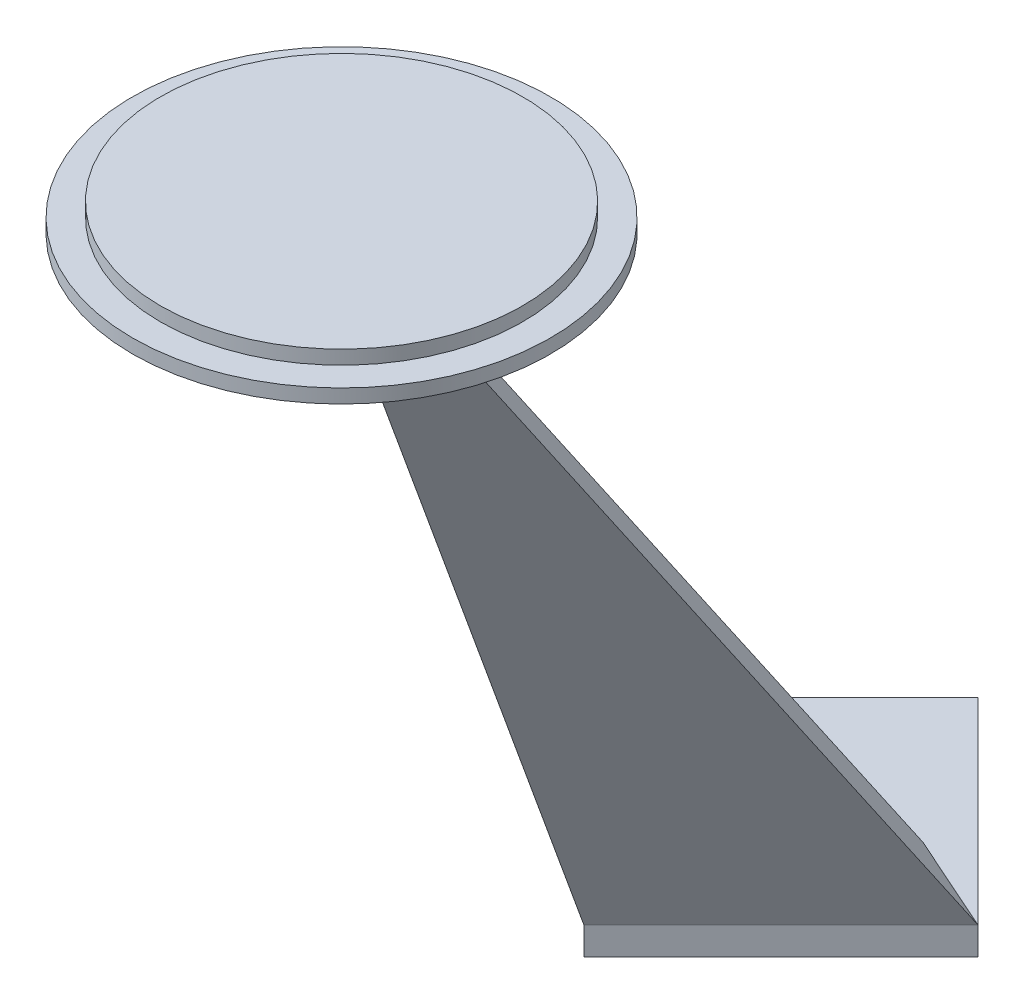
from build123d import *

# Parameters (mm, degrees)
SKETCH1_R           = 1.5
BOSS_EXTRUDE2_DEPTH = 2
BOSS_EXTRUDE3_DEPTH = 55
CUT_EXTRUDE1_DEPTH  = 2
CUT_EXTRUDE2_DEPTH  = 2
SKETCH8_R           = 15
BOSS_EXTRUDE6_DEPTH = 2
CUT_EXTRUDE3_START  = -1
SKETCH12_R          = 15
SKETCH12_R_2        = 13
CUT_EXTRUDE3_DEPTH  = 1


with BuildPart() as part:
    # Sketch1 → Boss-Extrude2 (new body)
    with BuildSketch(Plane(origin=(0, 0, 0), x_dir=(1, 0, 0), z_dir=(0, 1, 0))):
        Polygon((0, 14.142135624), (-14.142135624, 0), (0, -14.142135624), (14.142135624, 0), align=None)
        with Locations(Location((0, 0, 0), (0, 0, 270))):
            Circle(SKETCH1_R, mode=Mode.SUBTRACT)
    extrude(amount=BOSS_EXTRUDE2_DEPTH)

    # Sketch3 → Boss-Extrude3 (add, along a direction that is not the sketch's normal)
    with BuildSketch(Plane(origin=(0, 2, 0), x_dir=(1, 0, 0), z_dir=(0, 1, 0))):
        Polygon((0, -14.142135624), (14.142135624, 0), (12, 0), (0, -12), (-12, 0), (-14.142135624, 0), align=None)
    extrude(amount=BOSS_EXTRUDE3_DEPTH, dir=(0, 0.9396926207859093, 0.34202014332566616))

    # Sketch5 → Cut-Extrude1 (cut)
    with BuildSketch(Plane(origin=(6.290436868, -2.289531781, 6.290436868), x_dir=(0.643493123501823, -0.23421234290964707, -0.7287394448186825), z_dir=(0.6847910787717363, -0.24924356936395234, 0.6847910787717364))):
        Polygon((8.63194234, 6.716280495), (-17.181272543, 55.28250268), (-34.646941723, 50.929296953), align=None)
    extrude(amount=-CUT_EXTRUDE1_DEPTH, mode=Mode.SUBTRACT)

    # Sketch6 → Cut-Extrude2 (cut)
    with BuildSketch(Plane(origin=(-6.290436868, -2.289531781, 6.290436868), x_dir=(0.6434931235018196, 0.23421234290964207, 0.7287394448186869), z_dir=(-0.6847910787717418, -0.24924356936395037, 0.6847910787717316))):
        Polygon((17.181272543, 55.28250268), (34.646941723, 50.929296953), (-8.63194234, 6.716280495), align=None)
    extrude(amount=-CUT_EXTRUDE2_DEPTH, mode=Mode.SUBTRACT)

    # Sketch8 → Boss-Extrude6 (add)
    with BuildSketch(Plane(origin=(0, 53.683094143, 0), x_dir=(1, 0, 0), z_dir=(0, 1, 0))):
        with Locations(Location((0, -31.539029944, 0), (0, 0, 270))):
            Circle(SKETCH8_R)
    extrude(amount=BOSS_EXTRUDE6_DEPTH)

    # Sketch12 → Cut-Extrude3 (cut)
    with BuildSketch(Plane(origin=(0, 55.683094143, 0), x_dir=(1, 0, 0), z_dir=(0, 1, 0)).offset(CUT_EXTRUDE3_START)):
        with Locations(Location((0, -31.539029944, 0), (0, 0, 270))):
            Circle(SKETCH12_R)
        with Locations(Location((0, -31.539029944, 0), (0, 0, 270))):
            Circle(SKETCH12_R_2, mode=Mode.SUBTRACT)
    extrude(amount=CUT_EXTRUDE3_DEPTH, mode=Mode.SUBTRACT)


solid = part.part
